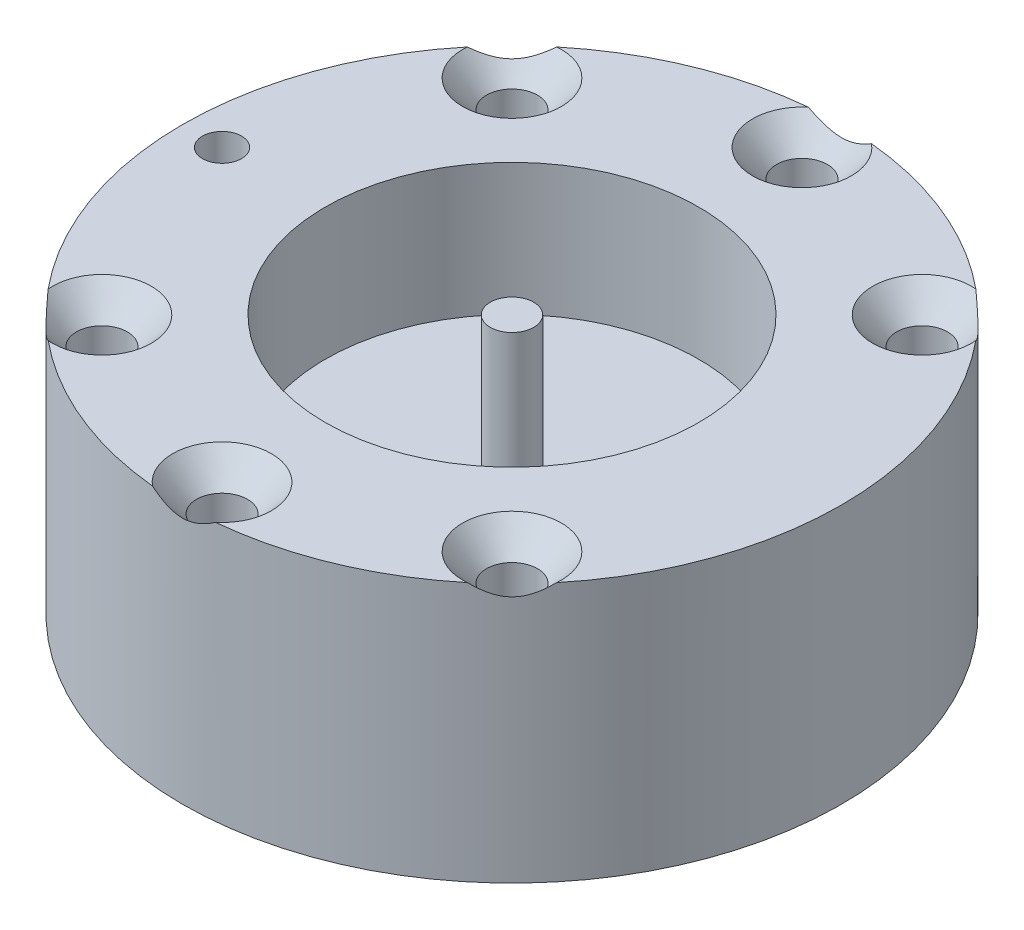
from build123d import *

# Parameters (mm, degrees)
OUTER_R                                        = 19.05
BODY_DEPTH                                     = 14.986
INNER_R                                        = 12.573
POCKET_DEPTH                                   = 4.826
CSK_FOR_4_FLAT_HEAD_MACHINE_SCREW1_D           = 2.9464
CSK_FOR_4_FLAT_HEAD_MACHINE_SCREW1_CSINK_D     = 5.715
CSK_FOR_4_FLAT_HEAD_MACHINE_SCREW1_CSINK_ANGLE = 82
SCREW_HOLES_COUNT                              = 4
POST_START                                     = 4.826
POST_SKETCH_R                                  = 1.0033
POST_DEPTH                                     = 4.826
POSTS_COUNT                                    = 4
CUT_EXTRUDE1_START                             = 14.986
SOLONOID_SKETCH_R                              = 10.795
SOLONOID_SKETCH_R_2                            = 1.2573
CUT_EXTRUDE1_DEPTH                             = 7.62
F_4_40_TAPPED_HOLE1_D                          = 2.2606


with BuildPart() as part:
    # outer → Body (new body)
    with BuildSketch(Plane(origin=(0, 0, 0), x_dir=(1, 0, 0), z_dir=(0, 1, 0))):
        with Locations(Location((0, 0, 0), (0, 0, 90))):
            Circle(OUTER_R)
    extrude(amount=BODY_DEPTH)

    # inner → Pocket (cut)
    with BuildSketch(Plane(origin=(0, 0, 0), x_dir=(1, 0, 0), z_dir=(0, 1, 0))):
        with Locations(Location((0, 0, 0), (0, 0, 270))):
            Circle(INNER_R)
    extrude(amount=POCKET_DEPTH, mode=Mode.SUBTRACT)

    # CSK for #4 Flat Head Machine Screw1 (through all)
    with Locations(Plane(origin=(0, 14.986, 0), x_dir=(1, 0, 0), z_dir=(0, 1, 0))):
        with Locations((-11.85393808, 11.85393808)):
            csk_for_4_flat_head_machine_screw1 = CounterSinkHole(CSK_FOR_4_FLAT_HEAD_MACHINE_SCREW1_D / 2, CSK_FOR_4_FLAT_HEAD_MACHINE_SCREW1_CSINK_D / 2, counter_sink_angle=CSK_FOR_4_FLAT_HEAD_MACHINE_SCREW1_CSINK_ANGLE)

    # Screw Holes: CSK for #4 Flat Head Machine Screw1 ×4 about axis
    screw_holes_axis = Axis((0, 0, 0), (0, 1, 0))
    for i in range(1, SCREW_HOLES_COUNT):
        add(csk_for_4_flat_head_machine_screw1.rotate(screw_holes_axis, i * 360 / SCREW_HOLES_COUNT), mode=Mode.SUBTRACT)

    # Post Sketch → Post (add)
    with BuildSketch(Plane(origin=(0, 0, 0), x_dir=(1, 0, 0), z_dir=(0, 1, 0)).offset(POST_START)):
        with Locations(Location((0, -5.715, 0), (0, 0, 270))):
            Circle(POST_SKETCH_R)
        with Locations(Location((5.298351111, -5.298351111, 0), (0, 0, 270))):
            Circle(POST_SKETCH_R)
    post = extrude(amount=-POST_DEPTH)

    # Posts: Post ×4 about axis
    posts_axis = Axis((0, 0, 0), (0, 1, 0))
    for i in range(1, POSTS_COUNT):
        add(post.rotate(posts_axis, i * 360 / POSTS_COUNT))

    # Solonoid Sketch → Cut-Extrude1 (cut)
    with BuildSketch(Plane(origin=(0, 0, 0), x_dir=(1, 0, 0), z_dir=(0, 1, 0)).offset(CUT_EXTRUDE1_START)):
        with Locations(Location((0, 0, 0), (0, 0, 270))):
            Circle(SOLONOID_SKETCH_R)
        with Locations(Location((0, 0, 0), (0, 0, 270))):
            Circle(SOLONOID_SKETCH_R_2, mode=Mode.SUBTRACT)
    extrude(amount=-CUT_EXTRUDE1_DEPTH, mode=Mode.SUBTRACT)

    # Sketch-Pattern1: CSK for #4 Flat Head Machine Screw1 at 2 more places
    with Locations((11.853938, 0, -4.910062), (11.853938, 0, 28.617938)):
        add(csk_for_4_flat_head_machine_screw1, mode=Mode.SUBTRACT)

    # #4-40 Tapped Hole1 (through all)
    with Locations(Plane(origin=(0, 14.986, 0), x_dir=(1, 0, 0), z_dir=(0, 1, 0))):
        with Locations((-16.764, 0)):
            Hole(F_4_40_TAPPED_HOLE1_D / 2)


solid = part.part
